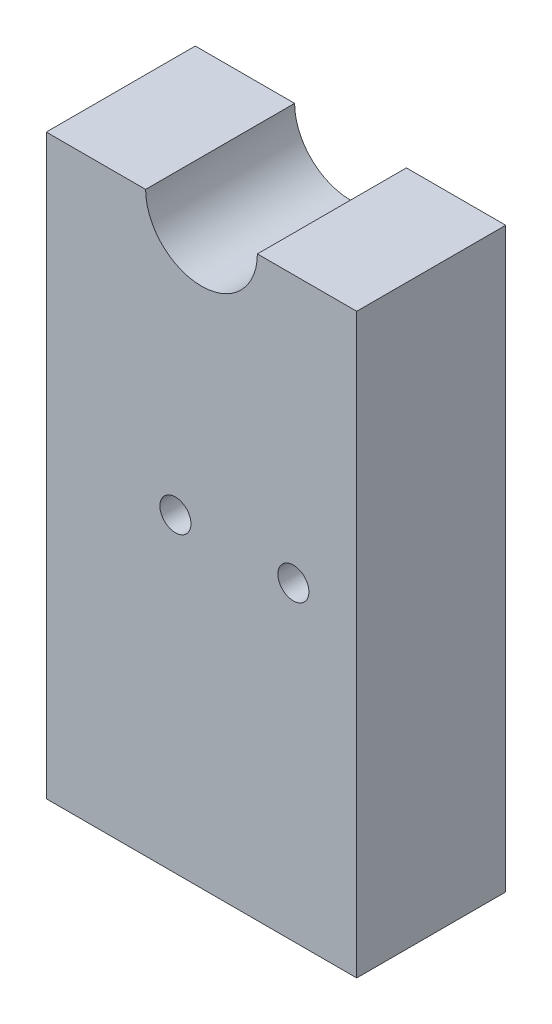
from build123d import *

# Parameters (mm, degrees)
BOSS_EXTRUDE1_DEPTH     = 12
CUT_EXTRUDE1_DEPTH      = 50.623583103
CUT_EXTRUDE1_DEPTH_BACK = 50.623583103
SKETCH2_R               = 1.25


with BuildPart() as part:
    # Sketch1 → Boss-Extrude1 (new body)
    with BuildSketch(Plane.XY):
        with BuildLine():
            Line((-12.5, 0), (12.5, 0))
            Line((12.5, 0), (12.5, 46.5))
            Line((12.5, 46.5), (4.5, 46.5))
            ThreePointArc((4.5, 46.5), (0, 42), (-4.5, 46.5))
            Line((-4.5, 46.5), (-12.5, 46.5))
            Line((-12.5, 46.5), (-12.5, 0))
        make_face()
    extrude(amount=BOSS_EXTRUDE1_DEPTH)

    # Sketch2 → Cut-Extrude1 (cut, two sides: drawn at the far end of the back side and taken through both)
    with BuildSketch(Plane(origin=(0, 0, 0), x_dir=(-1, 0, 0), z_dir=(0, 0, -1)).offset(-CUT_EXTRUDE1_DEPTH_BACK)):
        with Locations((-7.4, 25)):
            Circle(SKETCH2_R)
        with Locations((2.1, 25)):
            Circle(SKETCH2_R)
    extrude(amount=CUT_EXTRUDE1_DEPTH + CUT_EXTRUDE1_DEPTH_BACK, mode=Mode.SUBTRACT)


solid = part.part
